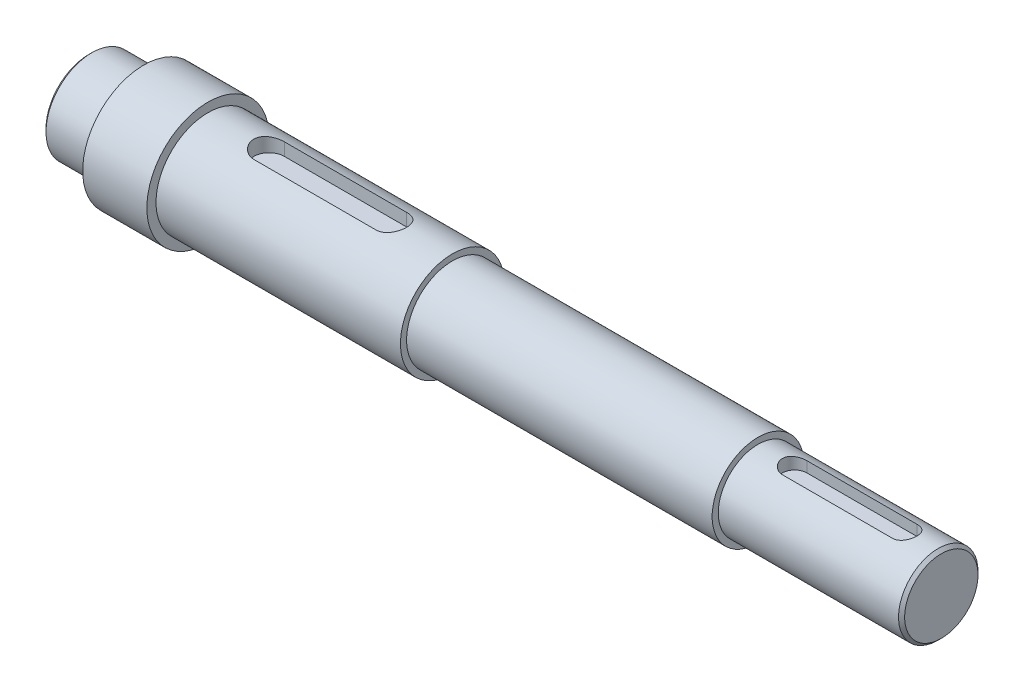
from build123d import *

# Parameters (mm, degrees)
BOSS_EXTRUDE1_DEPTH      = 40
BOSS_EXTRUDE1_DEPTH_BACK = 40
SKETCH1_R                = 17
CUT_EXTRUDE1_DEPTH       = 4.9
SKETCH3_R                = 20
BOSS_EXTRUDE2_DEPTH      = 21
SKETCH4_R                = 15
BOSS_EXTRUDE3_DEPTH      = 18
CHAMFER1_SIZE            = 1
BOSS_EXTRUDE4_START      = 100
SKETCH5_R                = 15
BOSS_EXTRUDE4_DEPTH      = 100
SKETCH6_R                = 13
BOSS_EXTRUDE5_DEPTH      = 60
CUT_EXTRUDE2_DEPTH       = 4.1
CHAMFER2_SIZE            = 1


with BuildPart() as part:
    # Sketch1 → Boss-Extrude1 (new, two sides: drawn at the far end of the back side and taken through both)
    with BuildSketch(Plane(origin=(0, 0, 0), x_dir=(0, 0, -1), z_dir=(1, 0, 0)).offset(-BOSS_EXTRUDE1_DEPTH_BACK)):
        Circle(SKETCH1_R)
    extrude(amount=BOSS_EXTRUDE1_DEPTH + BOSS_EXTRUDE1_DEPTH_BACK)

    # Sketch2 → Cut-Extrude1 (cut)
    with BuildSketch(Plane(origin=(0, 17, 0), x_dir=(1, 0, 0), z_dir=(0, 1, 0))):
        with BuildLine():
            Line((-20, 5), (20, 5))
            ThreePointArc((20, 5), (25, 0), (20, -5))
            Line((20, -5), (-20, -5))
            ThreePointArc((-20, -5), (-25, 0), (-20, 5))
        make_face()
    extrude(amount=-CUT_EXTRUDE1_DEPTH, mode=Mode.SUBTRACT)

    # Sketch3 → Boss-Extrude2 (add)
    with BuildSketch(Plane.ZY.offset(40)):
        Circle(SKETCH3_R)
    extrude(amount=BOSS_EXTRUDE2_DEPTH)

    # Sketch4 → Boss-Extrude3 (add)
    with BuildSketch(Plane.ZY.offset(61)):
        Circle(SKETCH4_R)
    extrude(amount=BOSS_EXTRUDE3_DEPTH)

    # Chamfer1
    chamfer1_edges = [part.edges().sort_by_distance(p)[0] for p in [
        (-79, 0, -15),
    ]]
    chamfer(chamfer1_edges, length=CHAMFER1_SIZE)

    # Sketch5 → Boss-Extrude4 (add)
    with BuildSketch(Plane(origin=(40, 0, 0), x_dir=(0, 0, -1), z_dir=(1, 0, 0)).offset(BOSS_EXTRUDE4_START)):
        Circle(SKETCH5_R)
    extrude(amount=-BOSS_EXTRUDE4_DEPTH)

    # Sketch6 → Boss-Extrude5 (add)
    with BuildSketch(Plane(origin=(140, 0, 0), x_dir=(0, 0, -1), z_dir=(1, 0, 0))):
        Circle(SKETCH6_R)
    extrude(amount=BOSS_EXTRUDE5_DEPTH)

    # Sketch7 → Cut-Extrude2 (cut)
    with BuildSketch(Plane(origin=(0, 13, 0), x_dir=(1, 0, 0), z_dir=(0, 1, 0))):
        with BuildLine():
            Line((152, 4), (188, 4))
            ThreePointArc((188, 4), (192, 0), (188, -4))
            Line((188, -4), (152, -4))
            ThreePointArc((152, -4), (148, 0), (152, 4))
        make_face()
    extrude(amount=-CUT_EXTRUDE2_DEPTH, mode=Mode.SUBTRACT)

    # Chamfer2
    chamfer2_edges = [part.edges().sort_by_distance(p)[0] for p in [
        (200, 0, 13),
    ]]
    chamfer(chamfer2_edges, length=CHAMFER2_SIZE)


solid = part.part
